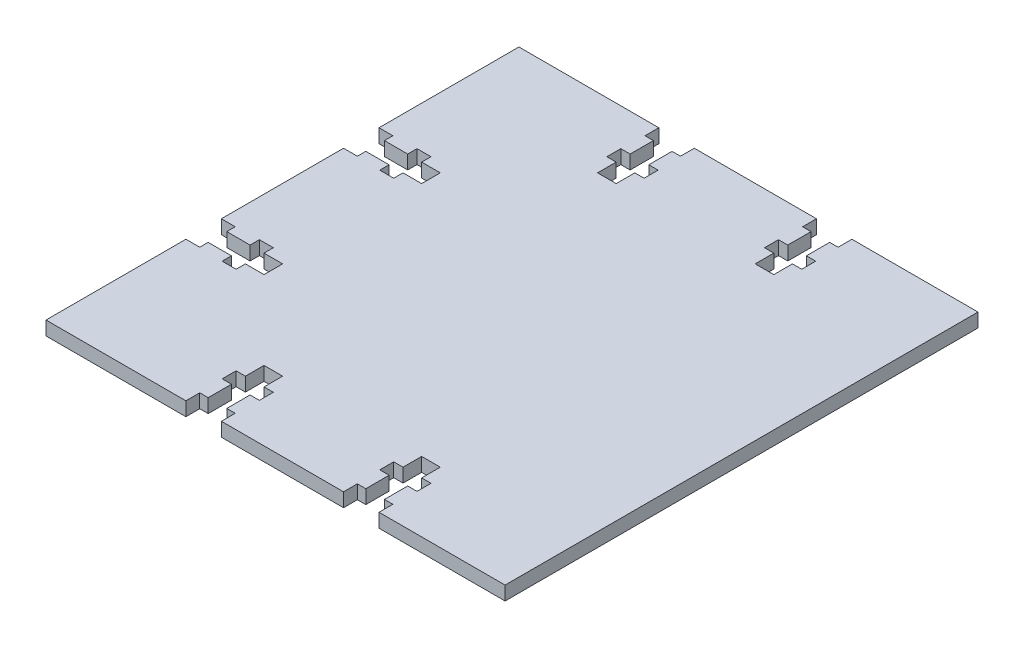
from build123d import *

# Parameters (mm, degrees)
SKETCH_1_W            = 101.6
SKETCH_1_H            = 101.6
EXTRUDE_1_DEPTH       = 2.9718
CUT_EXTRUDE_1_DEPTH   = 144.714827333
MIRROR_2_COPY_1_DEPTH = 144.714827333
CUT_EXTRUDE_3_DEPTH   = 144.714827333
SKETCH_2_W            = 101.6
SKETCH_2_H            = 2.9718
CUT_EXTRUDE_4_DEPTH   = 2.9718


with BuildPart() as part:
    # 草图1 → 凸台-拉伸1 (new body)
    with BuildSketch(Plane(origin=(0, 0, 0), x_dir=(1, 0, 0), z_dir=(0, 1, 0))):
        with Locations((50.8, 50.8)):
            Rectangle(SKETCH_1_W, SKETCH_1_H)
    extrude(amount=EXTRUDE_1_DEPTH)

    # 草图1<3> → 切除-拉伸1 (cut, through all)
    with BuildSketch(Plane(origin=(0, 0, 0), x_dir=(1, 0, 0), z_dir=(0, 1, 0))):
        Polygon((37.676666667, 98.6282), (37.676666667, 101.6), (30.056666667, 101.6), (30.056666667, 98.6282), (31.866666667, 98.6282), (31.866666667, 93.6282), (29.866666667, 93.6282), (29.866666667, 90.6282), (31.866666667, 90.6282), (31.866666667, 86.6282), (35.866666667, 86.6282), (35.866666667, 90.6282), (37.866666667, 90.6282), (37.866666667, 93.6282), (35.866666667, 93.6282), (35.866666667, 98.6282), align=None)
    cut_extrude_1 = extrude(amount=CUT_EXTRUDE_1_DEPTH, mode=Mode.SUBTRACT)

    # 镜向1: 切除-拉伸1 across plane
    add(cut_extrude_1.mirror(Plane(origin=(0, 0, -50.8), x_dir=(1, 0, 0), z_dir=(0, 0, -1))), mode=Mode.SUBTRACT)

    # 镜向2: 切除-拉伸1 across plane
    add(cut_extrude_1.mirror(Plane(origin=(50.8, 0, 0), x_dir=(0, 0, 1), z_dir=(1, 0, 0))), mode=Mode.SUBTRACT)

    # 镜向2 copy 1 sketch → 镜向2 copy 1 (cut, through all)
    with BuildSketch(Plane(origin=(101.6, 0, -101.6), x_dir=(-1, 0, 0), z_dir=(0, 1, 0))):
        Polygon((37.676666667, 98.6282), (37.676666667, 101.6), (30.056666667, 101.6), (30.056666667, 98.6282), (31.866666667, 98.6282), (31.866666667, 93.6282), (29.866666667, 93.6282), (29.866666667, 90.6282), (31.866666667, 90.6282), (31.866666667, 86.6282), (35.866666667, 86.6282), (35.866666667, 90.6282), (37.866666667, 90.6282), (37.866666667, 93.6282), (35.866666667, 93.6282), (35.866666667, 98.6282), align=None)
    extrude(amount=MIRROR_2_COPY_1_DEPTH, mode=Mode.SUBTRACT)

    # 草图1<4> → 切除-拉伸3 (cut, through all)
    with BuildSketch(Plane(origin=(0, 0, 0), x_dir=(1, 0, 0), z_dir=(0, 1, 0))):
        Polygon((0, 71.543333333), (0, 63.923333333), (2.9718, 63.923333333), (2.9718, 65.733333333), (7.9718, 65.733333333), (7.9718, 63.733333333), (10.9718, 63.733333333), (10.9718, 65.733333333), (14.9718, 65.733333333), (14.9718, 69.733333333), (10.9718, 69.733333333), (10.9718, 71.733333333), (7.9718, 71.733333333), (7.9718, 69.733333333), (2.9718, 69.733333333), (2.9718, 71.543333333), align=None)
    cut_extrude_3 = extrude(amount=CUT_EXTRUDE_3_DEPTH, mode=Mode.SUBTRACT)

    # 镜向3: 切除-拉伸3 across plane
    add(cut_extrude_3.mirror(Plane(origin=(0, 0, -50.8), x_dir=(1, 0, 0), z_dir=(0, 0, -1))), mode=Mode.SUBTRACT)

    # 草图2 → 切除-拉伸4 (cut)
    with BuildSketch(Plane(origin=(101.6, 0, 0), x_dir=(0, 0, -1), z_dir=(1, 0, 0))):
        with Locations((50.8, 1.4859)):
            Rectangle(SKETCH_2_W, SKETCH_2_H)
    extrude(amount=-CUT_EXTRUDE_4_DEPTH, mode=Mode.SUBTRACT)


solid = part.part
